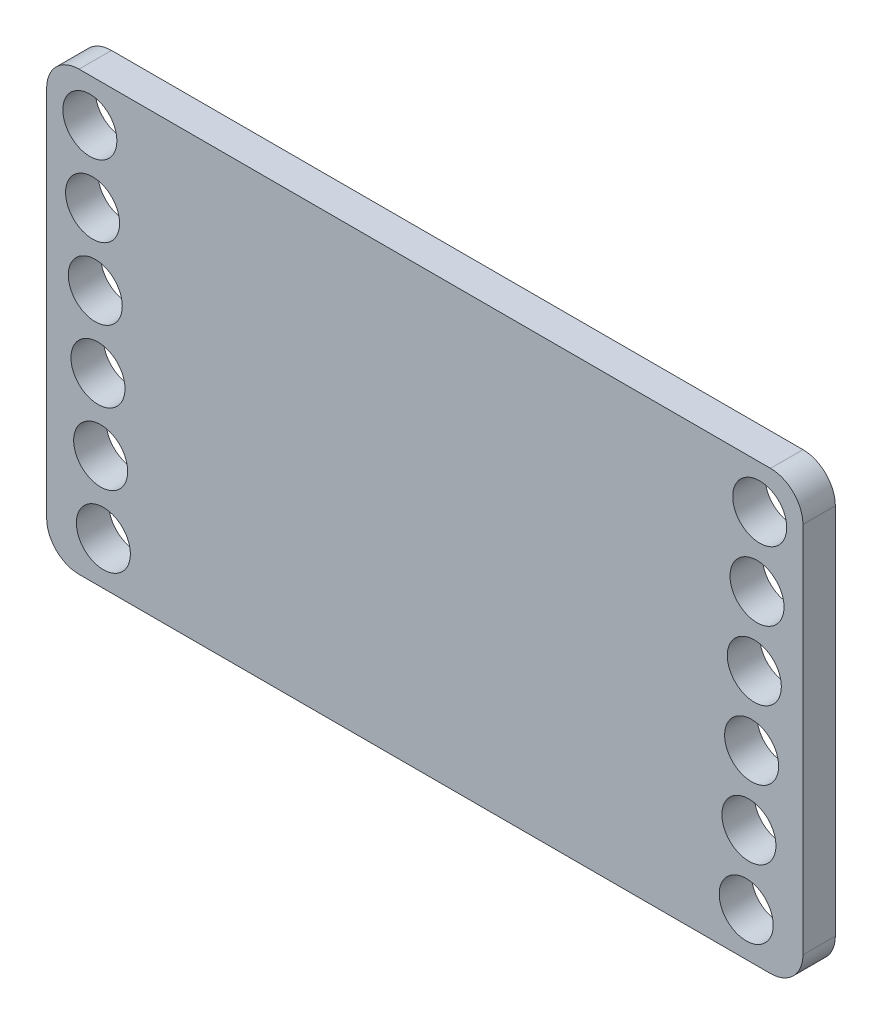
from build123d import *

# Parameters (mm, degrees)
SKETCH1_W           = 70
SKETCH1_H           = 40.5
SKETCH1_R           = 2.5
BOSS_EXTRUDE1_DEPTH = 3
FILLET1_R           = 3


with BuildPart() as part:
    # Sketch1 → Boss-Extrude1 (new body)
    with BuildSketch(Plane.XY):
        with Locations((0, 19.75)):
            Rectangle(SKETCH1_W, SKETCH1_H)
        with Locations((-29.75, 3.5)):
            Circle(SKETCH1_R, mode=Mode.SUBTRACT)
        with Locations((-30, 10)):
            Circle(SKETCH1_R, mode=Mode.SUBTRACT)
        with Locations((-30.25, 16.5)):
            Circle(SKETCH1_R, mode=Mode.SUBTRACT)
        with Locations((-30.5, 23)):
            Circle(SKETCH1_R, mode=Mode.SUBTRACT)
        with Locations((-30.75, 29.5)):
            Circle(SKETCH1_R, mode=Mode.SUBTRACT)
        with Locations((-31, 36)):
            Circle(SKETCH1_R, mode=Mode.SUBTRACT)
        with Locations((29.75, 3.5)):
            Circle(SKETCH1_R, mode=Mode.SUBTRACT)
        with Locations((30, 10)):
            Circle(SKETCH1_R, mode=Mode.SUBTRACT)
        with Locations((30.25, 16.5)):
            Circle(SKETCH1_R, mode=Mode.SUBTRACT)
        with Locations((30.5, 23)):
            Circle(SKETCH1_R, mode=Mode.SUBTRACT)
        with Locations((30.75, 29.5)):
            Circle(SKETCH1_R, mode=Mode.SUBTRACT)
        with Locations((31, 36)):
            Circle(SKETCH1_R, mode=Mode.SUBTRACT)
    extrude(amount=BOSS_EXTRUDE1_DEPTH)

    # Fillet1
    fillet1_edges = [part.edges().sort_by_distance(p)[0] for p in [
        (-35, 40, 1.5),
        (35, 40, 1.5),
        (35, -0.5, 1.5),
        (-35, -0.5, 1.5),
    ]]
    fillet(fillet1_edges, radius=FILLET1_R)


solid = part.part
